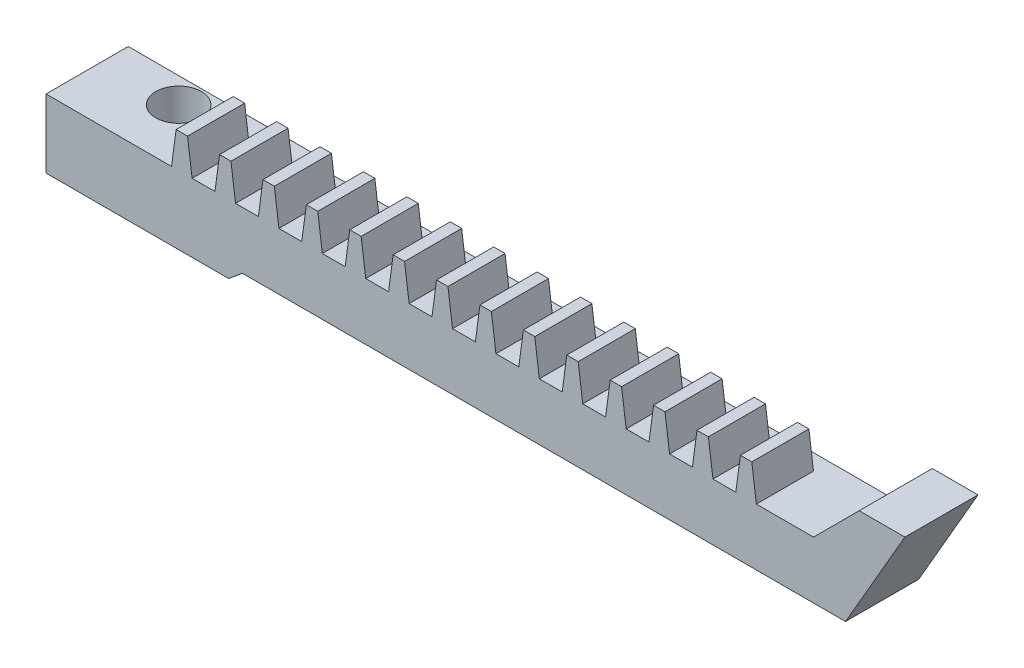
from build123d import *

# Parameters (mm, degrees)
BOSS_EXTRUDE1_DEPTH     = 18
CUT_EXTRUDE3_START      = 10
CUT_EXTRUDE3_DEPTH      = 200.444934928
BOSS_EXTRUDE2_DEPTH     = 12.5
LPATTERN1_COUNT         = 12
LPATTERN1_PITCH         = 9.5
LPATTERN1_COL_COUNT     = 3
LPATTERN1_COL_PITCH     = 9.5
CUT_EXTRUDE2_DEPTH      = 191.497725367
CUT_EXTRUDE2_DEPTH_BACK = 191.497725367
SKETCH5_R               = 5


with BuildPart() as part:
    # Sketch1 → Boss-Extrude1 (new body)
    with BuildSketch(Plane.XY):
        Polygon((0, 0), (167.990381057, 0), (177.990381057, 10), (187.990381057, 10), (175, -12.5), (42.979383981, -12.5), (40, -15), (0, -15), align=None)
    extrude(amount=BOSS_EXTRUDE1_DEPTH)

    # Sketch6 → Cut-Extrude3 (cut, through all)
    with BuildSketch(Plane(origin=(0, 0, 0), x_dir=(1, 0, 0), z_dir=(0, 1, 0)).offset(CUT_EXTRUDE3_START)):
        Polygon((187.990381057, 0), (187.990381057, -2), (42.979383981, -2), (40, 0), align=None)
    extrude(amount=-CUT_EXTRUDE3_DEPTH, mode=Mode.SUBTRACT)

    # Sketch3 → Boss-Extrude2 (add)
    with BuildSketch(Plane.XY.offset(18)):
        Polygon((46.479383981, 0), (50.979383981, 0), (49.979383981, 7.5), (47.479383981, 7.5), align=None)
    boss_extrude2 = extrude(amount=-BOSS_EXTRUDE2_DEPTH)

    # LPattern1: Boss-Extrude2 ×12
    with Locations(*[(i * LPATTERN1_PITCH, 0, 0) for i in range(1, LPATTERN1_COUNT)]):
        add(boss_extrude2)

    # LPattern1 col: Boss-Extrude2 ×3
    with Locations(*[(-i * LPATTERN1_COL_PITCH, 0, 0) for i in range(1, LPATTERN1_COL_COUNT)]):
        add(boss_extrude2)

    # Sketch5 → Cut-Extrude2 (cut, two sides: drawn at the far end of the back side and taken through both)
    with BuildSketch(Plane.XZ.offset(15).offset(-CUT_EXTRUDE2_DEPTH_BACK)):
        with Locations((16.55, 5.52014012)):
            Circle(SKETCH5_R)
    extrude(amount=CUT_EXTRUDE2_DEPTH + CUT_EXTRUDE2_DEPTH_BACK, mode=Mode.SUBTRACT)


solid = part.part
